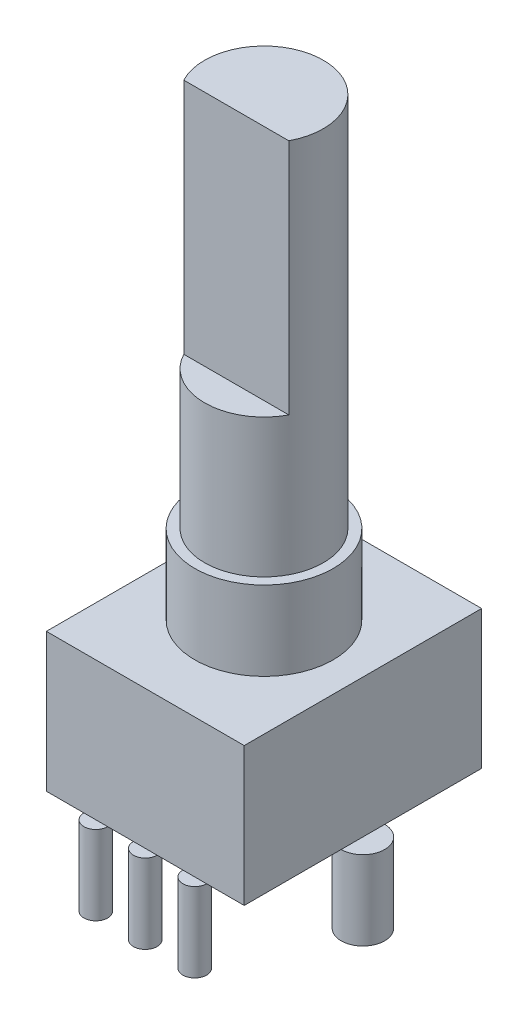
from build123d import *

# Parameters (mm, degrees)
SKETCH1_R           = 3
BOSS_EXTRUDE1_DEPTH = 7
BOSS_EXTRUDE2_DEPTH = 12
SKETCH3_R           = 3.5
BOSS_EXTRUDE3_DEPTH = 4
SKETCH4_W           = 10
SKETCH4_H           = 12
BOSS_EXTRUDE4_DEPTH = 7
SKETCH5_R           = 1.1
BOSS_EXTRUDE5_DEPTH = 4
SKETCH6_R           = 0.6
BOSS_EXTRUDE6_DEPTH = 4


with BuildPart() as part:
    # Sketch1 → Boss-Extrude1 (new body)
    with BuildSketch(Plane(origin=(0, 0, 0), x_dir=(1, 0, 0), z_dir=(0, 1, 0))):
        with Locations(Location((0, 0, 0), (0, 0, 270))):
            Circle(SKETCH1_R)
    extrude(amount=BOSS_EXTRUDE1_DEPTH)

    # Sketch2 → Boss-Extrude2 (add)
    with BuildSketch(Plane(origin=(0, 7, 0), x_dir=(1, 0, 0), z_dir=(0, 1, 0))):
        with BuildLine():
            Line((-2.653299832, -1.4), (2.653299832, -1.4))
            ThreePointArc((2.653299832, -1.4), (0, 3), (-2.653299832, -1.4))
        make_face()
    extrude(amount=BOSS_EXTRUDE2_DEPTH)

    # Sketch3 → Boss-Extrude3 (add)
    with BuildSketch(Plane.XZ):
        with Locations(Location((0, 0, 0), (0, 0, 270))):
            Circle(SKETCH3_R)
    extrude(amount=BOSS_EXTRUDE3_DEPTH)

    # Sketch4 → Boss-Extrude4 (add)
    with BuildSketch(Plane.XZ.offset(4)):
        Rectangle(SKETCH4_W, SKETCH4_H)
    extrude(amount=BOSS_EXTRUDE4_DEPTH)

    # Sketch5 → Boss-Extrude5 (add)
    with BuildSketch(Plane.XZ.offset(11)):
        with Locations(Location((-5.001245267, 0, 0), (0, 0, 89.93513768))):
            Circle(SKETCH5_R)
        with Locations(Location((5, 0, 0), (0, 0, 270))):
            Circle(SKETCH5_R)
    extrude(amount=BOSS_EXTRUDE5_DEPTH)

    # Sketch6 → Boss-Extrude6 (add)
    with BuildSketch(Plane.XZ.offset(11)):
        with Locations(Location((0, 6, 0), (0, 0, 180))):
            Circle(SKETCH6_R)
        with Locations(Location((2.5, 6, 0), (0, 0, 180))):
            Circle(SKETCH6_R)
        with Locations(Location((-2.5, 6, 0), (0, 0, 180))):
            Circle(SKETCH6_R)
    extrude(amount=BOSS_EXTRUDE6_DEPTH)


solid = part.part
